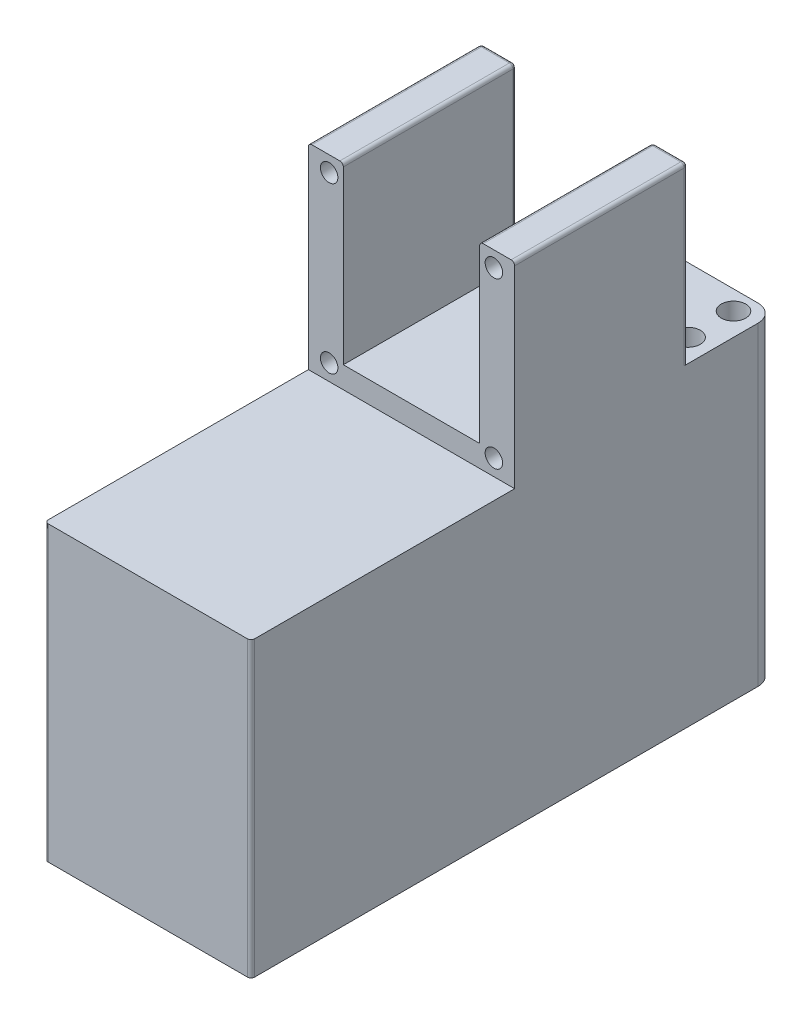
from build123d import *

# Parameters (mm, degrees)
SKETCH1_W                    = 59
SKETCH1_H                    = 30
BOSS_EXTRUDE1_DEPTH          = 30
SKETCH2_R                    = 2.5
SKETCH2_R_2                  = 3.5
CUT_EXTRUDE1_DEPTH           = 52.674461778
SKETCH3_W                    = 59
SKETCH3_H                    = 60
BOSS_EXTRUDE2_DEPTH          = 30
FILLET2_R                    = 5
FILLET3_R                    = 5
SKETCH5_W                    = 59
SKETCH5_H                    = 90
BOSS_EXTRUDE3_DEPTH          = 120
SKETCH6_W                    = 75.4
SKETCH6_H                    = 6.2
CUT_EXTRUDE2_DEPTH           = 120
SKETCH6_3_W                  = 49.48
SKETCH6_3_H                  = 50
BOSS_EXTRUDE4_DEPTH          = 10
F_5_0_5_DIAMETER_HOLE1_D     = 5
F_5_0_5_DIAMETER_HOLE1_DEPTH = 18.497848452
F_5_0_5_DIAMETER_HOLE1_TIP   = 1.502151548
SKETCH14_W                   = 49.48
SKETCH14_H                   = 50
BOSS_EXTRUDE6_DEPTH          = 10
F_5_0_5_DIAMETER_HOLE2_D     = 5
F_5_0_5_DIAMETER_HOLE2_DEPTH = 18.497848452
F_5_0_5_DIAMETER_HOLE2_TIP   = 1.502151548
FILLET4_R                    = 1
FILLET5_R                    = 1
FILLET6_R                    = 1
FILLET7_R                    = 1
FILLET8_R                    = 1
FILLET9_R                    = 1
FILLET10_R                   = 1
FILLET11_R                   = 1
F_5_0_5_DIAMETER_HOLE3_D     = 5
F_5_0_5_DIAMETER_HOLE3_DEPTH = 18.497848452
F_5_0_5_DIAMETER_HOLE3_TIP   = 1.502151548
CUT_EXTRUDE3_START           = -75
SKETCH21_R                   = 2.35
CUT_EXTRUDE3_DEPTH           = 20


with BuildPart() as part:
    # Sketch1 → Boss-Extrude1 (new body)
    with BuildSketch(Plane.XY):
        Rectangle(SKETCH1_W, SKETCH1_H)
        Polygon((4, 2.727207794), (6.572792206, 5.3), (8, 5.3), (8, 3.1), (10, 5.1), (10, 10), (5.1, 10), (3.1, 8), (5.3, 8), (5.3, 6.572792206), (2.727207794, 4), (-2.727207794, 4), (-5.3, 6.572792206), (-5.3, 8), (-3.1, 8), (-5.1, 10), (-10, 10), (-10, 5.1), (-8, 3.1), (-8, 5.3), (-6.572792206, 5.3), (-4, 2.727207794), (-4, -2.727207794), (-6.572792206, -5.3), (-8, -5.3), (-8, -3.1), (-10, -5.1), (-10, -10), (-5.1, -10), (-3.1, -8), (-5.3, -8), (-5.3, -6.572792206), (-2.727207794, -4), (2.727207794, -4), (5.3, -6.572792206), (5.3, -8), (3.1, -8), (5.1, -10), (10, -10), (10, -5.1), (8, -3.1), (8, -5.3), (6.572792206, -5.3), (4, -2.727207794), align=None, mode=Mode.SUBTRACT)
    extrude(amount=-BOSS_EXTRUDE1_DEPTH)

    # Sketch2 → Cut-Extrude1 (cut, through all)
    with BuildSketch(Plane(origin=(0, 15, 0), x_dir=(1, 0, 0), z_dir=(0, 1, 0))):
        with Locations(Location((0, 10, 0), (0, 0, 270))):
            Circle(SKETCH2_R)
        with Locations(Location((0, 20, 0), (0, 0, 270))):
            Circle(SKETCH2_R)
        with Locations(Location((-23, 24.5, 0), (0, 0, 270))):
            Circle(SKETCH2_R_2)
        with Locations(Location((23, 24.5, 0), (0, 0, 270))):
            Circle(SKETCH2_R_2)
        with Locations(Location((23, 11.5, 0), (0, 0, 270))):
            Circle(SKETCH2_R_2)
        with Locations(Location((-23, 11.5, 0), (0, 0, 270))):
            Circle(SKETCH2_R_2)
    extrude(amount=-CUT_EXTRUDE1_DEPTH, mode=Mode.SUBTRACT)

    # Sketch3 → Boss-Extrude2 (add)
    with BuildSketch(Plane.XY):
        with Locations((0, -45)):
            Rectangle(SKETCH3_W, SKETCH3_H)
    extrude(amount=-BOSS_EXTRUDE2_DEPTH)

    # Fillet2
    fillet2_edges = [part.edges().sort_by_distance(p)[0] for p in [
        (29.5, -30, -30),
    ]]
    fillet(fillet2_edges, radius=FILLET2_R)

    # Fillet3
    fillet3_edges = [part.edges().sort_by_distance(p)[0] for p in [
        (-29.5, -30, -30),
    ]]
    fillet(fillet3_edges, radius=FILLET3_R)

    # Sketch5 → Boss-Extrude3 (add)
    with BuildSketch(Plane.XY):
        with Locations((0, -30)):
            Rectangle(SKETCH5_W, SKETCH5_H)
    extrude(amount=BOSS_EXTRUDE3_DEPTH)

    # Sketch6 → Cut-Extrude2 (cut)
    with BuildSketch(Plane.ZY.offset(29.5)):
        with Locations((82.3, 11.9)):
            Rectangle(SKETCH6_W, SKETCH6_H)
    extrude(amount=-CUT_EXTRUDE2_DEPTH, mode=Mode.SUBTRACT)

    # Sketch6<3> → Boss-Extrude4 (add)
    with BuildSketch(Plane.ZY.offset(29.5)):
        with Locations((19.86, 40)):
            Rectangle(SKETCH6_3_W, SKETCH6_3_H)
    extrude(amount=-BOSS_EXTRUDE4_DEPTH)

    # Ø5.0 (5) Diameter Hole1
    with Locations(Plane.XY.offset(44.6)):
        with Locations((-23.56, 60.57)):
            Hole(F_5_0_5_DIAMETER_HOLE1_D / 2, depth=F_5_0_5_DIAMETER_HOLE1_DEPTH)
            with Locations((0, 0, -(F_5_0_5_DIAMETER_HOLE1_DEPTH + F_5_0_5_DIAMETER_HOLE1_TIP / 2))):  # 118° drill point
                Cone(0, F_5_0_5_DIAMETER_HOLE1_D / 2, F_5_0_5_DIAMETER_HOLE1_TIP, mode=Mode.SUBTRACT)

    # Sketch14 → Boss-Extrude6 (add)
    with BuildSketch(Plane(origin=(29.5, 0, 0), x_dir=(0, 0, -1), z_dir=(1, 0, 0))):
        with Locations((-19.86, 40)):
            Rectangle(SKETCH14_W, SKETCH14_H)
    extrude(amount=-BOSS_EXTRUDE6_DEPTH)

    # Ø5.0 (5) Diameter Hole2
    with Locations(Plane.XY.offset(44.6)):
        with Locations((23.56, 60.57)):
            Hole(F_5_0_5_DIAMETER_HOLE2_D / 2, depth=F_5_0_5_DIAMETER_HOLE2_DEPTH)
            with Locations((0, 0, -(F_5_0_5_DIAMETER_HOLE2_DEPTH + F_5_0_5_DIAMETER_HOLE2_TIP / 2))):  # 118° drill point
                Cone(0, F_5_0_5_DIAMETER_HOLE2_D / 2, F_5_0_5_DIAMETER_HOLE2_TIP, mode=Mode.SUBTRACT)

    # Fillet4
    fillet4_edges = [part.edges().sort_by_distance(p)[0] for p in [
        (-29.5, 40, -4.88),
    ]]
    fillet(fillet4_edges, radius=FILLET4_R)

    # Fillet5
    fillet5_edges = [part.edges().sort_by_distance(p)[0] for p in [
        (-19.5, 40, -4.88),
    ]]
    fillet(fillet5_edges, radius=FILLET5_R)

    # Fillet6
    fillet6_edges = [part.edges().sort_by_distance(p)[0] for p in [
        (29.5, 40, -4.88),
    ]]
    fillet(fillet6_edges, radius=FILLET6_R)

    # Fillet7
    fillet7_edges = [part.edges().sort_by_distance(p)[0] for p in [
        (19.5, 40, -4.88),
    ]]
    fillet(fillet7_edges, radius=FILLET7_R)

    # Fillet8
    fillet8_edges = [part.edges().sort_by_distance(p)[0] for p in [
        (-19.5, 65, 20.36),
        (-29.5, 65, 20.36),
        (-29.207106781, 65, -4.587106781),
        (-24.5, 65, -4.88),
        (-19.792893219, 65, -4.587106781),
    ]]
    fillet(fillet8_edges, radius=FILLET8_R)

    # Fillet9
    fillet9_edges = [part.edges().sort_by_distance(p)[0] for p in [
        (29.5, 65, 20.36),
        (29.207106781, 65, -4.587106781),
        (19.5, 65, 20.36),
        (24.5, 65, -4.88),
        (19.792893219, 65, -4.587106781),
    ]]
    fillet(fillet9_edges, radius=FILLET9_R)

    # Fillet10
    fillet10_edges = [part.edges().sort_by_distance(p)[0] for p in [
        (29.5, -33.1, 120),
    ]]
    fillet(fillet10_edges, radius=FILLET10_R)

    # Fillet11
    fillet11_edges = [part.edges().sort_by_distance(p)[0] for p in [
        (-29.5, -33.1, 120),
    ]]
    fillet(fillet11_edges, radius=FILLET11_R)

    # Ø5.0 (5) Diameter Hole3
    with Locations(Plane.XY.offset(44.6)):
        with Locations((-23.56, 13.43), (23.56, 13.43)):
            Hole(F_5_0_5_DIAMETER_HOLE3_D / 2, depth=F_5_0_5_DIAMETER_HOLE3_DEPTH)
            with Locations((0, 0, -(F_5_0_5_DIAMETER_HOLE3_DEPTH + F_5_0_5_DIAMETER_HOLE3_TIP / 2))):  # 118° drill point
                Cone(0, F_5_0_5_DIAMETER_HOLE3_D / 2, F_5_0_5_DIAMETER_HOLE3_TIP, mode=Mode.SUBTRACT)

    # Sketch21 → Cut-Extrude3 (cut)
    with BuildSketch(Plane(origin=(0, 0, 0), x_dir=(1, 0, 0), z_dir=(0, 1, 0)).offset(CUT_EXTRUDE3_START)):
        with Locations(Location((0, -70.33, 0), (0, 0, 90))):
            Circle(SKETCH21_R)
        with Locations(Location((0, -20.66, 0), (0, 0, 90))):
            Circle(SKETCH21_R)
    extrude(amount=CUT_EXTRUDE3_DEPTH, mode=Mode.SUBTRACT)


solid = part.part
